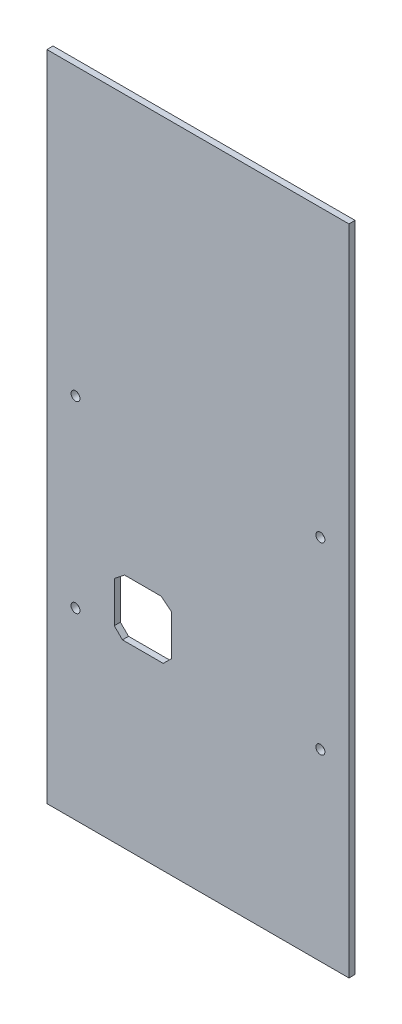
from build123d import *

# Parameters (mm, degrees)
ESQUISSE1_W             = 148
ESQUISSE1_H             = 330
BOSS_EXTRU_1_DEPTH      = 3
ENL_V_MAT_EXTRU_2_REACH = 182.859
ESQUISSE3_R             = 2.2
ENL_V_MAT_EXTRU_3_REACH = 182.859
ESQUISSE4_W             = 148
ESQUISSE4_H             = 10
ENL_V_MAT_EXTRU_4_REACH = 182.859


with BuildPart() as part:
    # Esquisse1 → Boss.-Extru.1 (new body)
    with BuildSketch(Plane.XY):
        Rectangle(ESQUISSE1_W, ESQUISSE1_H)
    extrude(amount=BOSS_EXTRU_1_DEPTH)

    # Esquisse3 → Enlèv. mat.-Extru.2 (cut, up to next)
    with BuildSketch(Plane.XY.offset(3), mode=Mode.PRIVATE) as enl_v_mat_extru_2_sk1:
        with Locations((60, -75)):
            Circle(ESQUISSE3_R)
    enl_v_mat_extru_2_tool1 = extrude(enl_v_mat_extru_2_sk1.sketch, amount=-ENL_V_MAT_EXTRU_2_REACH, mode=Mode.PRIVATE) & part.part
    # Esquisse3 → Enlèv. mat.-Extru.2 (cut, up to next)
    with BuildSketch(Plane.XY.offset(3), mode=Mode.PRIVATE) as enl_v_mat_extru_2_sk2:
        with Locations((60, 15)):
            Circle(ESQUISSE3_R)
    enl_v_mat_extru_2_tool2 = extrude(enl_v_mat_extru_2_sk2.sketch, amount=-ENL_V_MAT_EXTRU_2_REACH, mode=Mode.PRIVATE) & part.part
    enl_v_mat_extru_2_1 = enl_v_mat_extru_2_tool1.solids().sort_by_distance((60, -75, 3))[0]
    add(enl_v_mat_extru_2_1, mode=Mode.SUBTRACT)
    enl_v_mat_extru_2_2 = enl_v_mat_extru_2_tool2.solids().sort_by_distance((60, 15, 3))[0]
    add(enl_v_mat_extru_2_2, mode=Mode.SUBTRACT)
    enl_v_mat_extru_2 = enl_v_mat_extru_2_1 + enl_v_mat_extru_2_2  # Enlèv. mat.-Extru.2 as one shape, for the pattern or mirror that repeats it

    # Esquisse4 → Enlèv. mat.-Extru.3 (cut, up to next)
    with BuildSketch(Plane.XY.offset(3), mode=Mode.PRIVATE) as enl_v_mat_extru_3_sk1:
        with Locations((0, 160)):
            Rectangle(ESQUISSE4_W, ESQUISSE4_H)
    enl_v_mat_extru_3_tool1 = extrude(enl_v_mat_extru_3_sk1.sketch, amount=-ENL_V_MAT_EXTRU_3_REACH, mode=Mode.PRIVATE) & part.part
    add(enl_v_mat_extru_3_tool1.solids().sort_by_distance((0, 160, 3))[0], mode=Mode.SUBTRACT)

    # Symétrie1: Enlèv. mat.-Extru.2 across plane
    add(enl_v_mat_extru_2.mirror(Plane(origin=(0, 0, 0), x_dir=(0, 0, 1), z_dir=(1, 0, 0))), mode=Mode.SUBTRACT)

    # Esquisse5 → Enlèv. mat.-Extru.4 (cut, up to next)
    with BuildSketch(Plane(origin=(0, 0, 0), x_dir=(-1, 0, 0), z_dir=(0, 0, -1)), mode=Mode.PRIVATE) as enl_v_mat_extru_4_sk1:
        Polygon((17, -77), (37, -77), (41, -73), (41, -63), (41, -53), (36, -49), (18, -49), (13, -53), (13, -63), (13, -73), align=None)
    enl_v_mat_extru_4_tool1 = extrude(enl_v_mat_extru_4_sk1.sketch, amount=-ENL_V_MAT_EXTRU_4_REACH, mode=Mode.PRIVATE) & part.part
    add(enl_v_mat_extru_4_tool1.solids().sort_by_distance((-27, -63.067736, 0))[0], mode=Mode.SUBTRACT)


solid = part.part
